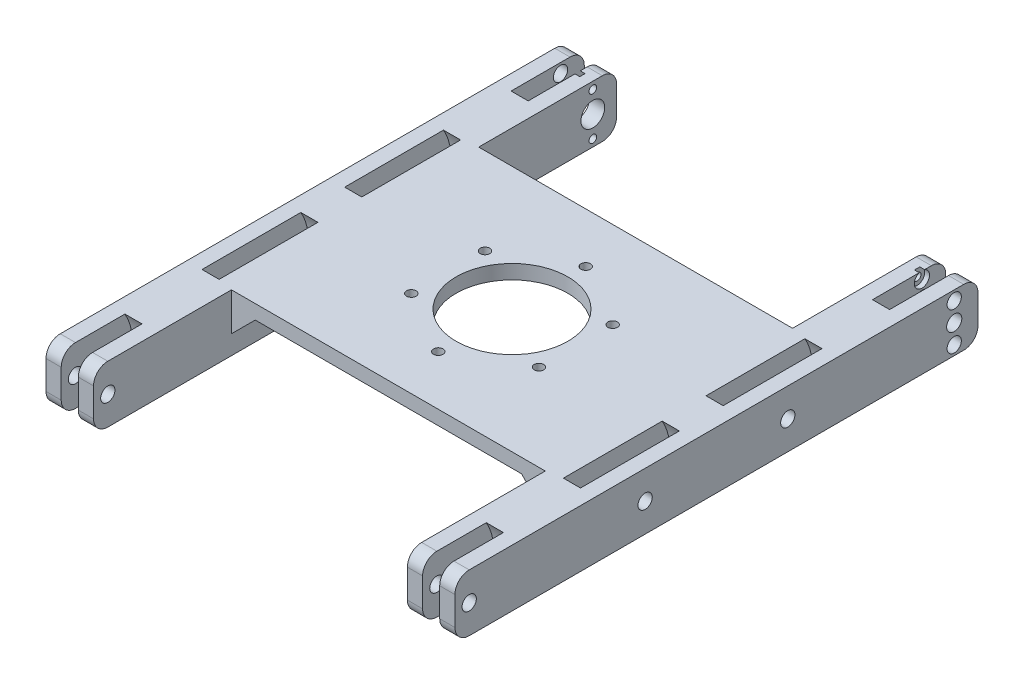
from build123d import *

# Parameters (mm, degrees)
SKETCH_1_W               = 66
SKETCH_1_H               = 52
EXTRUDE_1_DEPTH          = 3
SKETCH_2_W               = 110
SKETCH_2_H               = 12
EXTRUDE_2_DEPTH          = 10
CUT_EXTRUDE_1_REACH      = 96.244
SKETCH_4_R               = 1.6
SKETCH_4_R_2             = 1.5
SKETCH_8_R               = 12
CUT_EXTRUDE_4_DEPTH      = 1.8
CUT_EXTRUDE_2_REACH      = 88.383
SKETCH_5_R               = 0.8
SKETCH_5_R_2             = 2.5
CUT_EXTRUDE_5_REACH      = 96.244
SKETCH_10_R              = 1.5
SKETCH_11_R              = 1.6
CUT_EXTRUDE_6_DEPTH      = 1
FILLET_1_R               = 3
CUT_EXTRUDE_3_REACH      = 72.838
SKETCH_6_R               = 1
SKETCH_6_R_2             = 11.75
PATTERN_CIRCULAR_1_COUNT = 6
EXTRUDE_3_DEPTH          = 5
PATTERN_LINEAR_1_COUNT   = 4
PATTERN_LINEAR_1_PITCH   = 15.666666667
MIRROR_2_COPY_1_DEPTH    = 5
MIRROR_2_COPY_2_DEPTH    = 5
MIRROR_2_COPY_3_DEPTH    = 5


with BuildPart() as part:
    # 草图1 → 凸台-拉伸1 (new body)
    with BuildSketch(Plane(origin=(0, 0, 0), x_dir=(1, 0, 0), z_dir=(0, 1, 0))):
        Rectangle(SKETCH_1_W, SKETCH_1_H)
    extrude(amount=EXTRUDE_1_DEPTH)

    # 草图2 → 凸台-拉伸2 (add)
    with BuildSketch(Plane.ZY.offset(33)):
        with Locations((0, -3)):
            Rectangle(SKETCH_2_W, SKETCH_2_H)
    extrude_2 = extrude(amount=EXTRUDE_2_DEPTH)

    # 草图4 → 切除-拉伸1 (cut, up to next)
    with BuildSketch(Plane.ZY.offset(43), mode=Mode.PRIVATE) as cut_extrude_1_sk1:
        with Locations((-50, -3)):
            Circle(SKETCH_4_R)
    cut_extrude_1_tool1 = extrude(cut_extrude_1_sk1.sketch, amount=-CUT_EXTRUDE_1_REACH, mode=Mode.PRIVATE) & part.part
    # 草图4 → 切除-拉伸1 (cut, up to next)
    with BuildSketch(Plane.ZY.offset(43), mode=Mode.PRIVATE) as cut_extrude_1_sk2:
        with Locations((52, -3)):
            Circle(SKETCH_4_R_2)
    cut_extrude_1_tool2 = extrude(cut_extrude_1_sk2.sketch, amount=-CUT_EXTRUDE_1_REACH, mode=Mode.PRIVATE) & part.part
    # 草图4 → 切除-拉伸1 (cut, up to next)
    with BuildSketch(Plane.ZY.offset(43), mode=Mode.PRIVATE) as cut_extrude_1_sk3:
        with Locations((-15, -3)):
            Circle(SKETCH_4_R_2)
    cut_extrude_1_tool3 = extrude(cut_extrude_1_sk3.sketch, amount=-CUT_EXTRUDE_1_REACH, mode=Mode.PRIVATE) & part.part
    # 草图4 → 切除-拉伸1 (cut, up to next)
    with BuildSketch(Plane.ZY.offset(43), mode=Mode.PRIVATE) as cut_extrude_1_sk4:
        with Locations((15, -3)):
            Circle(SKETCH_4_R_2)
    cut_extrude_1_tool4 = extrude(cut_extrude_1_sk4.sketch, amount=-CUT_EXTRUDE_1_REACH, mode=Mode.PRIVATE) & part.part
    cut_extrude_1_1 = cut_extrude_1_tool1.solids().sort_by_distance((-43, -3, -50))[0]
    add(cut_extrude_1_1, mode=Mode.SUBTRACT)
    cut_extrude_1_2 = cut_extrude_1_tool2.solids().sort_by_distance((-43, -3, 52))[0]
    add(cut_extrude_1_2, mode=Mode.SUBTRACT)
    cut_extrude_1_3 = cut_extrude_1_tool3.solids().sort_by_distance((-43, -3, -15))[0]
    add(cut_extrude_1_3, mode=Mode.SUBTRACT)
    cut_extrude_1_4 = cut_extrude_1_tool4.solids().sort_by_distance((-43, -3, 15))[0]
    add(cut_extrude_1_4, mode=Mode.SUBTRACT)
    cut_extrude_1 = cut_extrude_1_1 + cut_extrude_1_2 + cut_extrude_1_3 + cut_extrude_1_4  # 切除-拉伸1 as one shape, for the pattern or mirror that repeats it

    # 草图8 → 切除-拉伸4 (cut, symmetric)
    with BuildSketch(Plane(origin=(-38, 0, 0), x_dir=(0, 0, -1), z_dir=(1, 0, 0))):
        with Locations((-52, -3)):
            Circle(SKETCH_8_R)
        with Locations((50, -3)):
            Circle(SKETCH_8_R)
        with BuildLine():
            Line((-27, -3), (-27, -9))
            Line((-27, -9), (-3, -9))
            Line((-3, -9), (-3, -3))
            ThreePointArc((-3, -3), (-15, 9), (-27, -3))
        make_face()
        with BuildLine():
            Line((3, -3), (3, -9))
            Line((3, -9), (27, -9))
            Line((27, -9), (27, -3))
            ThreePointArc((27, -3), (15, 9), (3, -3))
        make_face()
    cut_extrude_4 = extrude(amount=CUT_EXTRUDE_4_DEPTH, both=True, mode=Mode.SUBTRACT)

    # 草图5 → 切除-拉伸2 (cut, up to next)
    with BuildSketch(Plane.ZY.offset(33), mode=Mode.PRIVATE) as cut_extrude_2_sk1:
        with Locations(Location((-50, 1.5, 0), (0, 0, 180))):
            Circle(SKETCH_5_R)
    cut_extrude_2_tool1 = extrude(cut_extrude_2_sk1.sketch, amount=CUT_EXTRUDE_2_REACH, mode=Mode.PRIVATE) & part.part
    # 草图5 → 切除-拉伸2 (cut, up to next)
    with BuildSketch(Plane.ZY.offset(33), mode=Mode.PRIVATE) as cut_extrude_2_sk2:
        with Locations(Location((-50, -7.5, 0), (0, 0, 180))):
            Circle(SKETCH_5_R)
    cut_extrude_2_tool2 = extrude(cut_extrude_2_sk2.sketch, amount=CUT_EXTRUDE_2_REACH, mode=Mode.PRIVATE) & part.part
    # 草图5 → 切除-拉伸2 (cut, up to next)
    with BuildSketch(Plane.ZY.offset(33), mode=Mode.PRIVATE) as cut_extrude_2_sk3:
        with Locations(Location((-50, -3, 0), (0, 0, 180))):
            Circle(SKETCH_5_R_2)
    cut_extrude_2_tool3 = extrude(cut_extrude_2_sk3.sketch, amount=CUT_EXTRUDE_2_REACH, mode=Mode.PRIVATE) & part.part
    cut_extrude_2_1 = cut_extrude_2_tool1.solids().sort_by_distance((-33, 1.5, -50))[0]
    add(cut_extrude_2_1, mode=Mode.SUBTRACT)
    cut_extrude_2_2 = cut_extrude_2_tool2.solids().sort_by_distance((-33, -7.5, -50))[0]
    add(cut_extrude_2_2, mode=Mode.SUBTRACT)
    cut_extrude_2_3 = cut_extrude_2_tool3.solids().sort_by_distance((-33, -3, -50))[0]
    add(cut_extrude_2_3, mode=Mode.SUBTRACT)
    cut_extrude_2 = cut_extrude_2_1 + cut_extrude_2_2 + cut_extrude_2_3  # 切除-拉伸2 as one shape, for the pattern or mirror that repeats it

    # 草图10 → 切除-拉伸5 (cut, up to next)
    with BuildSketch(Plane.ZY.offset(43), mode=Mode.PRIVATE) as cut_extrude_5_sk1:
        with Locations((-50, -7)):
            Circle(SKETCH_10_R)
    cut_extrude_5_tool1 = extrude(cut_extrude_5_sk1.sketch, amount=-CUT_EXTRUDE_5_REACH, mode=Mode.PRIVATE) & part.part
    # 草图10 → 切除-拉伸5 (cut, up to next)
    with BuildSketch(Plane.ZY.offset(43), mode=Mode.PRIVATE) as cut_extrude_5_sk2:
        with Locations((-50, 1)):
            Circle(SKETCH_10_R)
    cut_extrude_5_tool2 = extrude(cut_extrude_5_sk2.sketch, amount=-CUT_EXTRUDE_5_REACH, mode=Mode.PRIVATE) & part.part
    cut_extrude_5_1 = cut_extrude_5_tool1.solids().sort_by_distance((-43, -7, -50))[0]
    add(cut_extrude_5_1, mode=Mode.SUBTRACT)
    cut_extrude_5_2 = cut_extrude_5_tool2.solids().sort_by_distance((-43, 1, -50))[0]
    add(cut_extrude_5_2, mode=Mode.SUBTRACT)
    cut_extrude_5 = cut_extrude_5_1 + cut_extrude_5_2  # 切除-拉伸5 as one shape, for the pattern or mirror that repeats it

    # 草图11 → 切除-拉伸6 (cut)
    with BuildSketch(Plane.ZY.offset(36.2)):
        with Locations((-50, 1.5)):
            Circle(SKETCH_11_R)
        with Locations((-50, -7.5)):
            Circle(SKETCH_11_R)
    cut_extrude_6 = extrude(amount=-CUT_EXTRUDE_6_DEPTH, mode=Mode.SUBTRACT)

    # 镜向1: 凸台-拉伸2, 切除-拉伸1, 切除-拉伸4, 切除-拉伸2, 切除-拉伸5, 切除-拉伸6 across plane
    add(extrude_2.mirror(Plane(origin=(0, 0, 0), x_dir=(0, 0, 1), z_dir=(1, 0, 0))))
    add(cut_extrude_1.mirror(Plane(origin=(0, 0, 0), x_dir=(0, 0, 1), z_dir=(1, 0, 0))), mode=Mode.SUBTRACT)
    add(cut_extrude_4.mirror(Plane(origin=(0, 0, 0), x_dir=(0, 0, 1), z_dir=(1, 0, 0))), mode=Mode.SUBTRACT)
    add(cut_extrude_2.mirror(Plane(origin=(0, 0, 0), x_dir=(0, 0, 1), z_dir=(1, 0, 0))), mode=Mode.SUBTRACT)
    add(cut_extrude_5.mirror(Plane(origin=(0, 0, 0), x_dir=(0, 0, 1), z_dir=(1, 0, 0))), mode=Mode.SUBTRACT)
    add(cut_extrude_6.mirror(Plane(origin=(0, 0, 0), x_dir=(0, 0, 1), z_dir=(1, 0, 0))), mode=Mode.SUBTRACT)

    # 圆角1
    fillet_1_edges = [part.edges().sort_by_distance(p)[0] for p in [
        (-41.4, 3, -55),
        (-41.4, -9, -55),
        (-41.4, -9, 55),
        (-41.4, 3, 55),
        (41.4, -9, -55),
        (41.4, 3, -55),
        (41.4, 3, 55),
        (41.4, -9, 55),
        (34.6, -9, 55),
        (34.6, 3, 55),
        (34.6, -9, -55),
        (34.6, 3, -55),
        (-34.6, 3, 55),
        (-34.6, -9, 55),
        (-34.6, -9, -55),
        (-34.6, 3, -55),
    ]]
    fillet(fillet_1_edges, radius=FILLET_1_R)

    # 草图6 → 切除-拉伸3 (cut, up to next)
    with BuildSketch(Plane(origin=(0, 3, 0), x_dir=(1, 0, 0), z_dir=(0, 1, 0)), mode=Mode.PRIVATE) as cut_extrude_3_sk1:
        with Locations(Location((0, 15.5, 0), (0, 0, 270))):
            Circle(SKETCH_6_R)
    cut_extrude_3_tool1 = extrude(cut_extrude_3_sk1.sketch, amount=-CUT_EXTRUDE_3_REACH, mode=Mode.PRIVATE) & part.part
    # 草图6 → 切除-拉伸3 (cut, up to next)
    with BuildSketch(Plane(origin=(0, 3, 0), x_dir=(1, 0, 0), z_dir=(0, 1, 0)), mode=Mode.PRIVATE) as cut_extrude_3_sk2:
        with Locations(Location((0, 0, 0), (0, 0, 270))):
            Circle(SKETCH_6_R_2)
    cut_extrude_3_tool2 = extrude(cut_extrude_3_sk2.sketch, amount=-CUT_EXTRUDE_3_REACH, mode=Mode.PRIVATE) & part.part
    cut_extrude_3_1 = cut_extrude_3_tool1.solids().sort_by_distance((0, 3, -15.5))[0]
    add(cut_extrude_3_1, mode=Mode.SUBTRACT)
    cut_extrude_3_2 = cut_extrude_3_tool2.solids().sort_by_distance((0, 3, 0))[0]
    add(cut_extrude_3_2, mode=Mode.SUBTRACT)
    cut_extrude_3 = cut_extrude_3_1 + cut_extrude_3_2  # 切除-拉伸3 as one shape, for the pattern or mirror that repeats it

    # 阵列(圆周)1: 切除-拉伸3 ×6 about axis
    pattern_circular_1_axis = Axis((0, 0, 0), (0, 1, 0))
    for i in range(1, PATTERN_CIRCULAR_1_COUNT):
        add(cut_extrude_3.rotate(pattern_circular_1_axis, i * 360 / PATTERN_CIRCULAR_1_COUNT), mode=Mode.SUBTRACT)

    # 草图9 → 凸台-拉伸3 (add)
    with BuildSketch(Plane(origin=(0, 0, -26), x_dir=(-1, 0, 0), z_dir=(0, 0, -1))):
        Polygon((33, 0), (28, 0), (33, -5), align=None)
    extrude_3 = extrude(amount=-EXTRUDE_3_DEPTH)

    # 阵列(线性)1: 凸台-拉伸3 ×4
    with Locations(*[(0, 0, i * PATTERN_LINEAR_1_PITCH) for i in range(1, PATTERN_LINEAR_1_COUNT)]):
        add(extrude_3)

    # 镜向2: 凸台-拉伸3 across plane
    add(extrude_3.mirror(Plane(origin=(0, 0, 0), x_dir=(0, 0, 1), z_dir=(1, 0, 0))))

    # 镜向2 copy 1 sketch → 镜向2 copy 1 (add)
    with BuildSketch(Plane(origin=(0, 0, -10.333333333), x_dir=(1, 0, 0), z_dir=(0, 0, -1))):
        Polygon((33, 0), (28, 0), (33, 5), align=None)
    extrude(amount=-MIRROR_2_COPY_1_DEPTH)

    # 镜向2 copy 2 sketch → 镜向2 copy 2 (add)
    with BuildSketch(Plane(origin=(0, 0, 5.333333333), x_dir=(1, 0, 0), z_dir=(0, 0, -1))):
        Polygon((33, 0), (28, 0), (33, 5), align=None)
    extrude(amount=-MIRROR_2_COPY_2_DEPTH)

    # 镜向2 copy 3 sketch → 镜向2 copy 3 (add)
    with BuildSketch(Plane(origin=(0, 0, 21), x_dir=(1, 0, 0), z_dir=(0, 0, -1))):
        Polygon((33, 0), (28, 0), (33, 5), align=None)
    extrude(amount=-MIRROR_2_COPY_3_DEPTH)


solid = part.part
